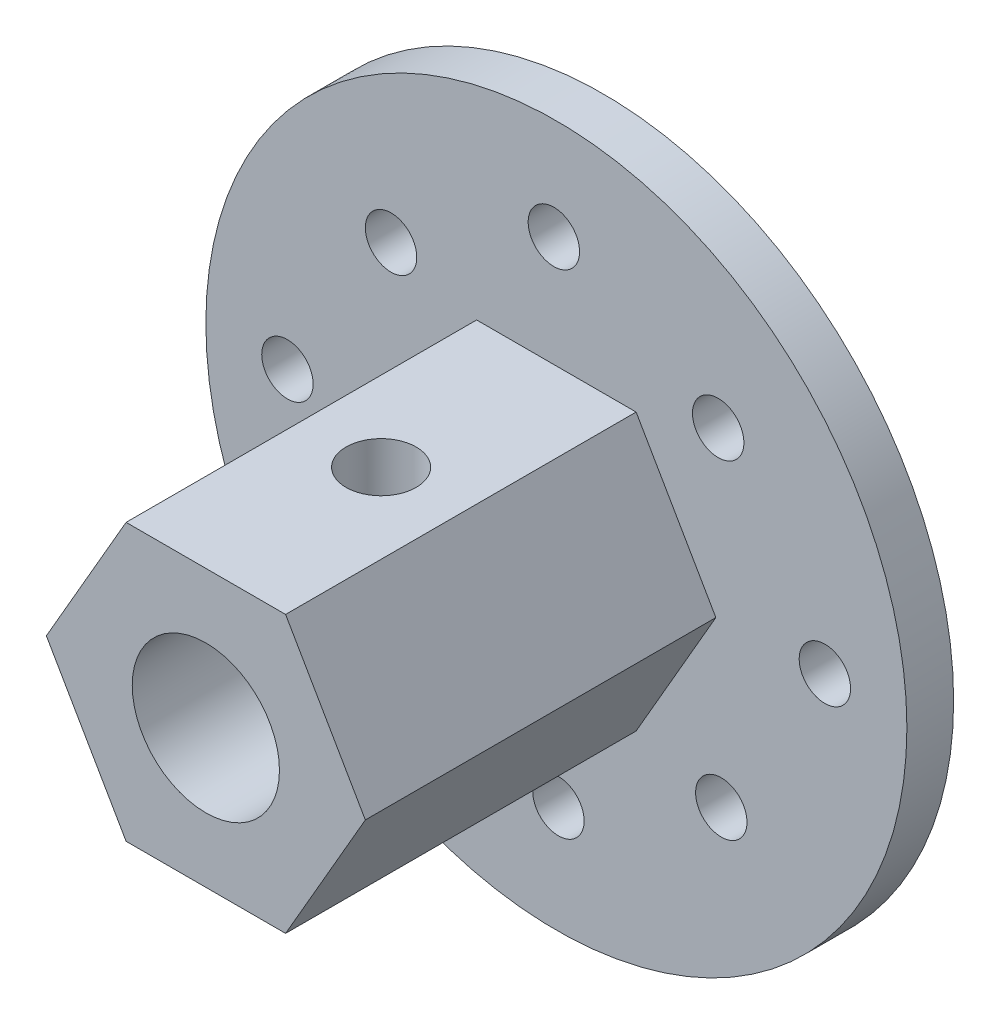
from build123d import *
from build123d.topology import SkipClean

# Parameters (mm, degrees)
SKETCH_1_R          = 3.15
EXTRUDE_1_DEPTH     = 15
EXTRUDE_START       = 2
SKETCH_2_R          = 15
SKETCH_2_R_2        = 3.15
SKETCH_2_R_3        = 1.1
EXTRUDE_2_DEPTH     = 2
SKETCH_3_R          = 1.5
CUT_EXTRUDE_1_DEPTH = 30.786812018


with BuildPart() as part:
    # 草图1 → 凸台-拉伸1 (new body)
    with BuildSketch(Plane.XY):
        Polygon((-3.4125, -5.910623381), (3.4125, -5.910623381), (6.825, 0), (3.4125, 5.910623381), (-3.4125, 5.910623381), (-6.825, 0), align=None)
        Circle(SKETCH_1_R, mode=Mode.SUBTRACT)
    extrude(amount=EXTRUDE_1_DEPTH)

    # 草图2 → 凸台-拉伸2 (add)
    with SkipClean():  # the faces are left unmerged after this step: merging them gives an invalid solid
        with BuildSketch(Plane(origin=(0, 0, 0), x_dir=(-1, 0, 0), z_dir=(0, 0, -1)).offset(EXTRUDE_START)):
            Circle(SKETCH_2_R)
            Circle(SKETCH_2_R_2, mode=Mode.SUBTRACT)
            with Locations((0.107841154, 10.641777672)):
                Circle(SKETCH_2_R_3, mode=Mode.SUBTRACT)
            with Locations((7.074701484, 6.949367968)):
                Circle(SKETCH_2_R_3, mode=Mode.SUBTRACT)
            with Locations((11.509282596, 0.034851677)):
                Circle(SKETCH_2_R_3, mode=Mode.SUBTRACT)
            with Locations((6.942357889, -7.050434427)):
                Circle(SKETCH_2_R_3, mode=Mode.SUBTRACT)
            with Locations((-0.08801923, -10.357308944)):
                Circle(SKETCH_2_R_3, mode=Mode.SUBTRACT)
            with Locations((-7.057604111, -6.919535443)):
                Circle(SKETCH_2_R_3, mode=Mode.SUBTRACT)
            with Locations((-11.489717031, 0.24936543)):
                Circle(SKETCH_2_R_3, mode=Mode.SUBTRACT)
            with Locations((-6.924524538, 7.077286558)):
                Circle(SKETCH_2_R_3, mode=Mode.SUBTRACT)
        extrude(amount=-EXTRUDE_2_DEPTH)

    # 草图3 → 切除-拉伸1 (cut, through all)
    with SkipClean():  # the faces are left unmerged after this step: merging them gives an invalid solid
        with BuildSketch(Plane(origin=(0, 5.910623381, 0), x_dir=(1, 0, 0), z_dir=(0, 1, 0))):
            with Locations(Location((0, -7.5, 0), (0, 0, 180))):
                Circle(SKETCH_3_R)
        extrude(amount=-CUT_EXTRUDE_1_DEPTH, mode=Mode.SUBTRACT)


solid = part.part
